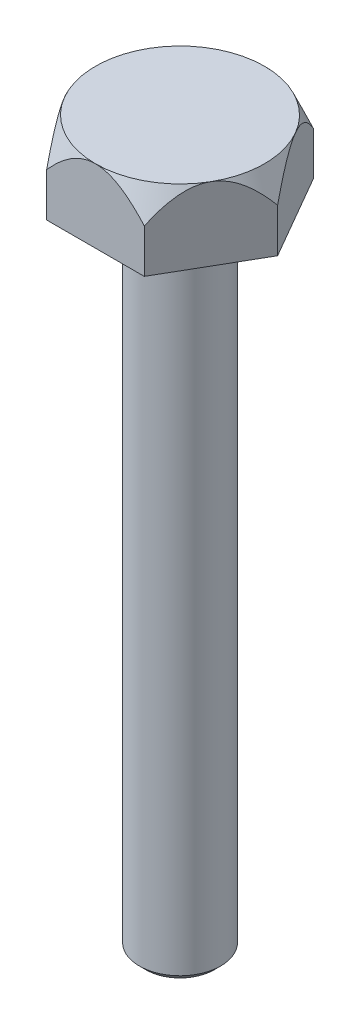
from build123d import *

# Parameters (mm, degrees)
BOSS_EXTRUDE1_DEPTH = 45
SKETCH2_OUTSIDE_W   = 237.294
SKETCH2_OUTSIDE_H   = 221.206
SKETCH2_OUTSIDE_R   = 52
CUT_EXTRUDE2_DEPTH  = 92.292569979
CUT_EXTRUDE2_DRAFT  = -24
SKETCH3_R           = 25
BOSS_EXTRUDE2_DEPTH = 400
CHAMFER1_SIZE       = 4


with BuildPart() as part:
    # Sketch1 → Boss-Extrude1 (new body)
    with BuildSketch(Plane(origin=(0, 0, 0), x_dir=(1, 0, 0), z_dir=(0, 1, 0))):
        Polygon((30.022213998, -52), (60.044427996, 0), (30.022213998, 52), (-30.022213998, 52), (-60.044427996, 0), (-30.022213998, -52), align=None)
    extrude(amount=BOSS_EXTRUDE1_DEPTH)


with BuildPart() as cut_extrude2_tool:
    # Sketch2 outside → Cut-Extrude2 (with draft: the straight prism first)
    with BuildSketch(Plane(origin=(0, 45, 0), x_dir=(1, 0, 0), z_dir=(0, 1, 0))):
        Rectangle(SKETCH2_OUTSIDE_W, SKETCH2_OUTSIDE_H)
        Circle(SKETCH2_OUTSIDE_R, mode=Mode.SUBTRACT)
    extrude(amount=-CUT_EXTRUDE2_DEPTH)
    # Cut-Extrude2: the draft: its side faces are tilted about the plane it starts from
    cut_extrude2_sides = [cut_extrude2_tool.faces().sort_by_distance(p)[0] for p in [
        (0, -1.146284989, 110.603),
        (118.647, -1.146284989, 0),
        (0, -1.146284989, -110.603),
        (-118.647, -1.146284989, 0),
        (-52, -1.146284989, 0),
    ]]
    draft(cut_extrude2_sides, Plane(origin=(0, 45, 0), x_dir=(1, 0, 0), z_dir=(0, 1, 0)), CUT_EXTRUDE2_DRAFT)


with BuildPart() as part_1:
    add(part.part)

    # Cut-Extrude2: cut by cut_extrude2_tool
    add(cut_extrude2_tool.part, mode=Mode.SUBTRACT)

    # Sketch3 → Boss-Extrude2 (add)
    with BuildSketch(Plane.XZ):
        with Locations(Location((0, 0, 0), (0, 0, 270))):
            Circle(SKETCH3_R)
    extrude(amount=BOSS_EXTRUDE2_DEPTH)

    # Chamfer1
    chamfer1_edges = [part_1.edges().sort_by_distance(p)[0] for p in [
        (0, -400, 25),
    ]]
    chamfer(chamfer1_edges, length=CHAMFER1_SIZE)


solid = part_1.part
